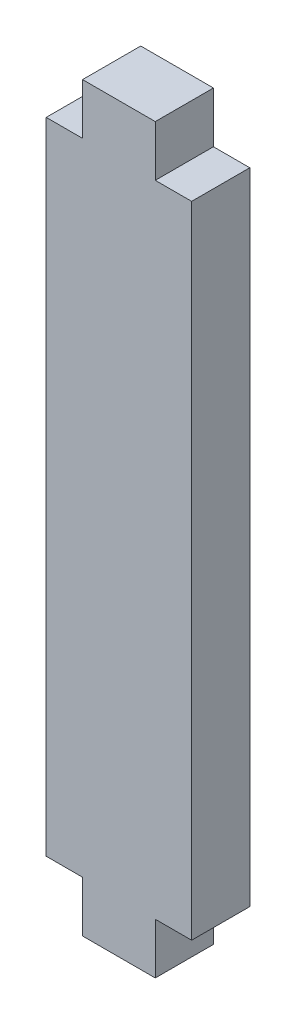
from build123d import *

# Parameters (mm, degrees)
BOSS_EXTRUDE1_DEPTH = 4


with BuildPart() as part:
    # Sketch1 → Boss-Extrude1 (new body)
    with BuildSketch(Plane.XY):
        Polygon((2.5, 22), (2.5, 25.5), (-2.5, 25.5), (-2.5, 22), (-5, 22), (-5, -22), (-2.5, -22), (-2.5, -25.5), (2.5, -25.5), (2.5, -22), (5, -22), (5, 22), align=None)
    extrude(amount=BOSS_EXTRUDE1_DEPTH)


solid = part.part
